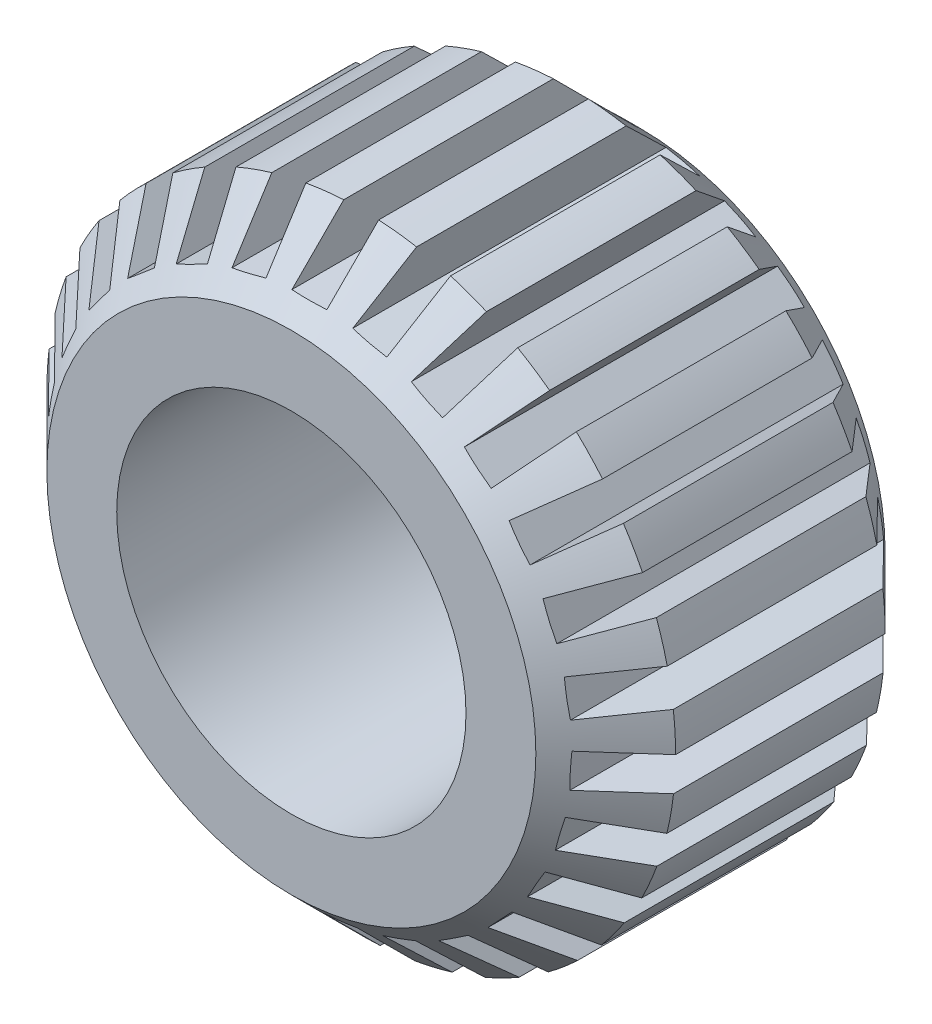
from build123d import *

# Parameters (mm, degrees)
SKETCH2_R           = 9
SKETCH2_R_2         = 5
BOSS_EXTRUDE1_DEPTH = 10
CHAMFER1_SIZE       = 2
CUT_EXTRUDE1_DEPTH  = 17.186414056
CIRPATTERN1_COUNT   = 27


with BuildPart() as part:
    # Sketch2 → Boss-Extrude1 (new body)
    with BuildSketch(Plane.XY):
        Circle(SKETCH2_R)
        Circle(SKETCH2_R_2, mode=Mode.SUBTRACT)
    extrude(amount=BOSS_EXTRUDE1_DEPTH)

    # Chamfer1
    chamfer1_edges = [part.edges().sort_by_distance(p)[0] for p in [
        (-9, 0, 0),
        (-9, 0, 10),
    ]]
    chamfer(chamfer1_edges, length=CHAMFER1_SIZE)

    # Sketch3 → Cut-Extrude1 (cut, through all)
    with BuildSketch(Plane.XY):
        with BuildLine():
            Line((0.5, 7.5), (0.5, 8.986100378))
            ThreePointArc((0.5, 8.986100378), (0, 9), (-0.5, 8.986100378))
            Line((-0.5, 8.986100378), (-0.5, 7.5))
            Line((-0.5, 7.5), (0.5, 7.5))
        make_face()
    cut_extrude1 = extrude(amount=CUT_EXTRUDE1_DEPTH, mode=Mode.SUBTRACT)

    # CirPattern1: Cut-Extrude1 ×27 about axis
    cirpattern1_axis = Axis((0, 0, 0), (0, 0, 1))
    for i in range(1, CIRPATTERN1_COUNT):
        add(cut_extrude1.rotate(cirpattern1_axis, i * 360 / CIRPATTERN1_COUNT), mode=Mode.SUBTRACT)


solid = part.part
